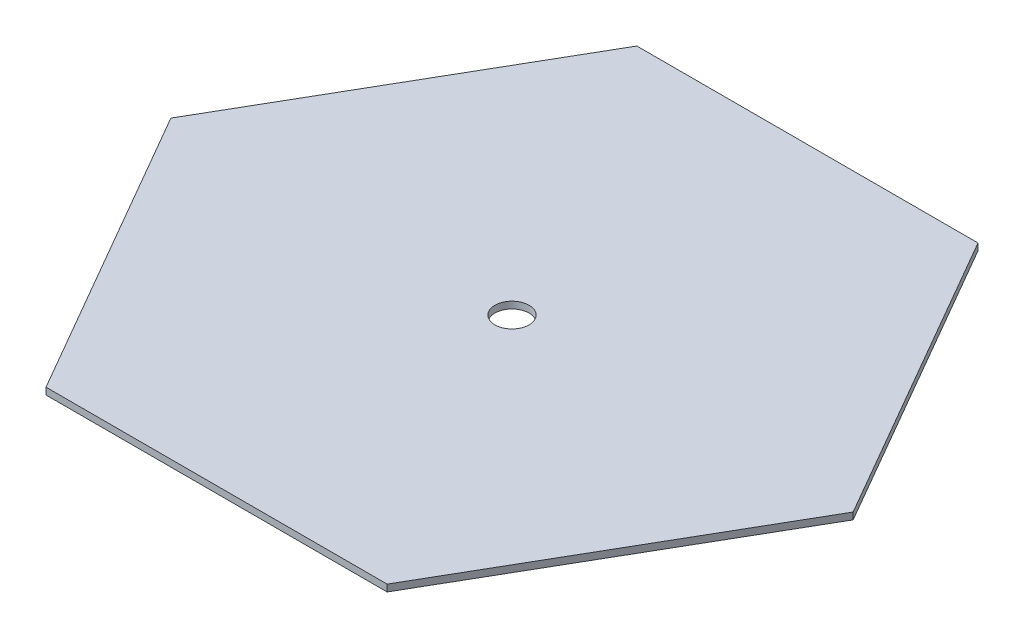
from build123d import *

# Parameters (mm, degrees)
BOSS_EXTRUDE1_DEPTH = 10
SKETCH4_R           = 25
CUT_EXTRUDE2_DEPTH  = 662.513416342


with BuildPart() as part:
    # Sketch1 → Boss-Extrude1 (new body)
    with BuildSketch(Plane(origin=(0, 0, 0), x_dir=(1, 0, 0), z_dir=(0, 1, 0))):
        Polygon((500, 0), (250, 433.012701892), (-250, 433.012701892), (-500, 0), (-250, -433.012701892), (250, -433.012701892), align=None)
    extrude(amount=BOSS_EXTRUDE1_DEPTH)

    # Sketch4 → Cut-Extrude2 (cut, through all)
    with BuildSketch(Plane.XZ):
        with Locations(Location((0, 0, 0), (0, 0, 270))):
            Circle(SKETCH4_R)
    extrude(amount=-CUT_EXTRUDE2_DEPTH, mode=Mode.SUBTRACT)


solid = part.part
